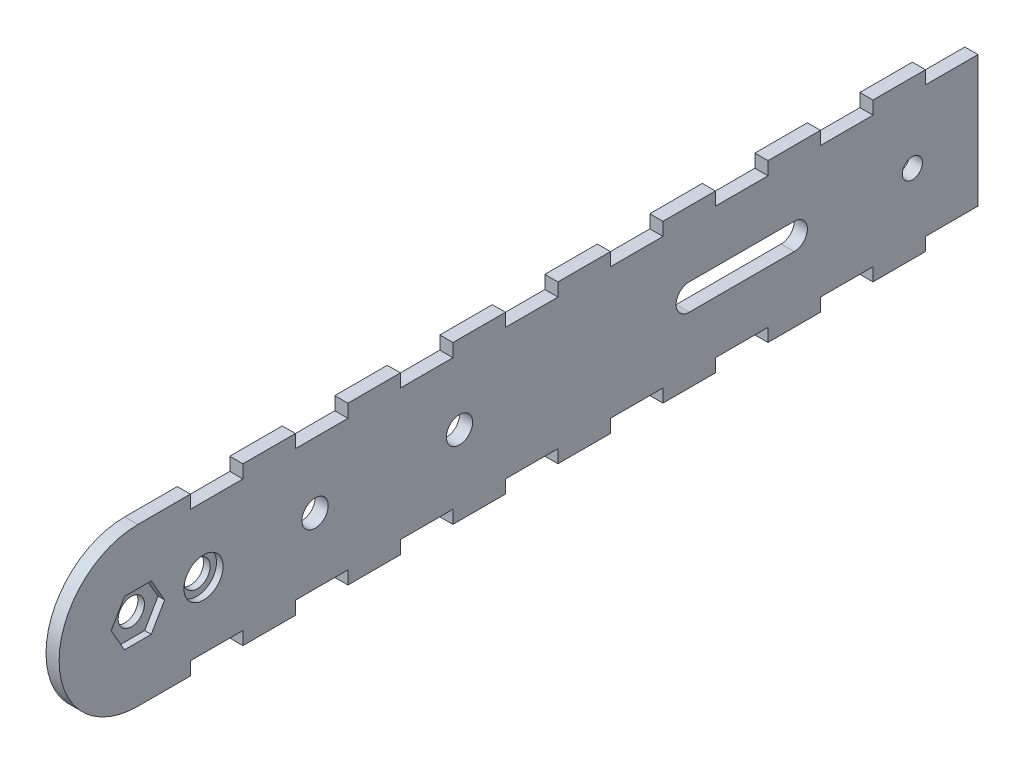
from build123d import *

# Parameters (mm, degrees)
SKETCH1_R           = 3.175
BOSS_EXTRUDE1_DEPTH = 3.175
SKETCH2_R           = 3.2004
SKETCH2_R_2         = 2.4384
SKETCH2_R_3         = 3.175
CUT_EXTRUDE2_DEPTH  = 205.115710138
SKETCH3_R           = 4.73075
CUT_EXTRUDE3_DEPTH  = 1.5875
CUT_EXTRUDE4_DEPTH  = 205.115710138


with BuildPart() as part:
    # Sketch1 → Boss-Extrude1 (new body)
    with BuildSketch(Plane(origin=(0, 0, 0), x_dir=(0, 0, -1), z_dir=(1, 0, 0))):
        with BuildLine():
            Line((12.7, 19.05), (0, 19.05))
            ThreePointArc((0, 19.05), (-19.05, 0), (0, -19.05))
            Line((0, -19.05), (12.7, -19.05))
            Line((12.7, -19.05), (12.7, -15.875))
            Line((12.7, -15.875), (25.4, -15.875))
            Line((25.4, -15.875), (25.4, -19.05))
            Line((25.4, -19.05), (38.1, -19.05))
            Line((38.1, -19.05), (38.1, -15.875))
            Line((38.1, -15.875), (50.8, -15.875))
            Line((50.8, -15.875), (50.8, -19.05))
            Line((50.8, -19.05), (63.5, -19.05))
            Line((63.5, -19.05), (63.5, -15.875))
            Line((63.5, -15.875), (76.2, -15.875))
            Line((76.2, -15.875), (76.2, -19.05))
            Line((76.2, -19.05), (88.9, -19.05))
            Line((88.9, -19.05), (88.9, -15.875))
            Line((88.9, -15.875), (101.6, -15.875))
            Line((101.6, -15.875), (101.6, -19.05))
            Line((101.6, -19.05), (114.3, -19.05))
            Line((114.3, -19.05), (114.3, -15.875))
            Line((114.3, -15.875), (127, -15.875))
            Line((127, -15.875), (127, -19.05))
            Line((127, -19.05), (139.7, -19.05))
            Line((139.7, -19.05), (139.7, -15.875))
            Line((139.7, -15.875), (152.4, -15.875))
            Line((152.4, -15.875), (152.4, -19.05))
            Line((152.4, -19.05), (165.1, -19.05))
            Line((165.1, -19.05), (165.1, -15.875))
            Line((165.1, -15.875), (177.8, -15.875))
            Line((177.8, -15.875), (177.8, -19.05))
            Line((177.8, -19.05), (190.5, -19.05))
            Line((190.5, -19.05), (190.5, -15.875))
            Line((190.5, -15.875), (203.2, -15.875))
            Line((203.2, -15.875), (203.2, 15.875))
            Line((203.2, 15.875), (190.5, 15.875))
            Line((190.5, 15.875), (190.5, 19.05))
            Line((190.5, 19.05), (177.8, 19.05))
            Line((177.8, 19.05), (177.8, 15.875))
            Line((177.8, 15.875), (165.1, 15.875))
            Line((165.1, 15.875), (165.1, 19.05))
            Line((165.1, 19.05), (152.4, 19.05))
            Line((152.4, 19.05), (152.4, 15.875))
            Line((152.4, 15.875), (139.7, 15.875))
            Line((139.7, 15.875), (139.7, 19.05))
            Line((139.7, 19.05), (127, 19.05))
            Line((127, 19.05), (127, 15.875))
            Line((127, 15.875), (114.3, 15.875))
            Line((114.3, 15.875), (114.3, 19.05))
            Line((114.3, 19.05), (101.6, 19.05))
            Line((101.6, 19.05), (101.6, 15.875))
            Line((101.6, 15.875), (88.9, 15.875))
            Line((88.9, 15.875), (88.9, 19.05))
            Line((88.9, 19.05), (76.2, 19.05))
            Line((76.2, 19.05), (76.2, 15.875))
            Line((76.2, 15.875), (63.5, 15.875))
            Line((63.5, 15.875), (63.5, 19.05))
            Line((63.5, 19.05), (50.8, 19.05))
            Line((50.8, 19.05), (50.8, 15.875))
            Line((50.8, 15.875), (38.1, 15.875))
            Line((38.1, 15.875), (38.1, 19.05))
            Line((38.1, 19.05), (25.4, 19.05))
            Line((25.4, 19.05), (25.4, 15.875))
            Line((25.4, 15.875), (12.7, 15.875))
            Line((12.7, 15.875), (12.7, 19.05))
        make_face()
        Circle(SKETCH1_R, mode=Mode.SUBTRACT)
    extrude(amount=BOSS_EXTRUDE1_DEPTH)

    # Sketch2 → Cut-Extrude2 (cut, through all)
    with BuildSketch(Plane(origin=(3.175, 0, 0), x_dir=(0, 0, -1), z_dir=(1, 0, 0))):
        with Locations((15.875, 0)):
            Circle(SKETCH2_R)
        with Locations((187.325, 0)):
            Circle(SKETCH2_R_2)
        with Locations((42.8625, 0)):
            Circle(SKETCH2_R_3)
        with Locations((77.7875, 0)):
            Circle(SKETCH2_R_3)
    extrude(amount=-CUT_EXTRUDE2_DEPTH, mode=Mode.SUBTRACT)

    # Sketch3 → Cut-Extrude3 (cut)
    with BuildSketch(Plane(origin=(3.175, 0, 0), x_dir=(0, 0, -1), z_dir=(1, 0, 0))):
        with Locations((15.875, 0)):
            Circle(SKETCH3_R)
        Polygon((3.229899478, -5.59435), (6.459798957, 0), (3.229899478, 5.59435), (-3.229899478, 5.59435), (-6.459798957, 0), (-3.229899478, -5.59435), align=None)
    extrude(amount=-CUT_EXTRUDE3_DEPTH, mode=Mode.SUBTRACT)

    # Sketch4 → Cut-Extrude4 (cut, through all)
    with BuildSketch(Plane(origin=(3.175, 0, 0), x_dir=(0, 0, -1), z_dir=(1, 0, 0))):
        with BuildLine():
            Line((133.35, 3.175), (158.75, 3.175))
            ThreePointArc((158.75, 3.175), (161.925, 0), (158.75, -3.175))
            Line((158.75, -3.175), (133.35, -3.175))
            ThreePointArc((133.35, -3.175), (130.175, 0), (133.35, 3.175))
        make_face()
    extrude(amount=-CUT_EXTRUDE4_DEPTH, mode=Mode.SUBTRACT)


solid = part.part
